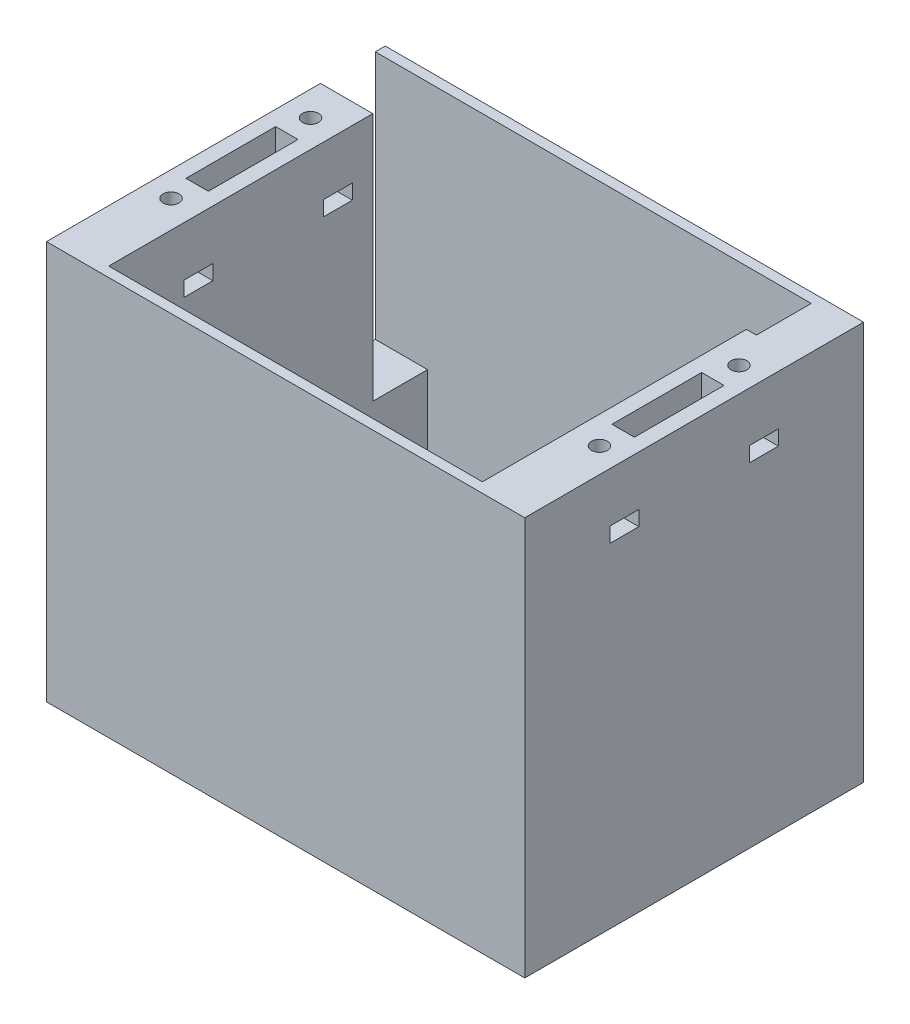
from build123d import *

# Parameters (mm, degrees)
SKETCH1_W                       = 96
SKETCH1_H                       = 68
BOSS_EXTRUDE1_DEPTH             = 80
SKETCH2_W                       = 75
SKETCH2_H                       = 64
CUT_EXTRUDE1_DEPTH              = 45
SKETCH3_W                       = 30
SKETCH3_H                       = 32
CUT_EXTRUDE2_DEPTH              = 8
SKETCH9_R                       = 1.8
CUT_EXTRUDE5_DEPTH              = 80.177016867
CHAMFER1_SIZE                   = 10
SKETCH10_R                      = 10
SKETCH10_R_2                    = 3.8
CUT_EXTRUDE7_DEPTH              = 13
CHAMFER2_SIZE                   = 3
CUT_EXTRUDE8_DEPTH              = 25
SKETCH12_R                      = 1.6
SKETCH12_W                      = 4.5
SKETCH12_H                      = 18
CUT_EXTRUDE9_DEPTH              = 70
SKETCH13_W                      = 5.8
SKETCH13_H                      = 3
CUT_EXTRUDE10_DEPTH             = 130.50675658
CUT_EXTRUDE11_DEPTH             = 5
CUT_EXTRUDE11_DIRECTION_2_REACH = 76.061


with BuildPart() as part:
    # Sketch1 → Boss-Extrude1 (new body)
    with BuildSketch(Plane(origin=(0, 0, 0), x_dir=(1, 0, 0), z_dir=(0, 1, 0))):
        Rectangle(SKETCH1_W, SKETCH1_H)
    extrude(amount=BOSS_EXTRUDE1_DEPTH)

    # Sketch2 → Cut-Extrude1 (cut)
    with BuildSketch(Plane(origin=(0, 80, 0), x_dir=(1, 0, 0), z_dir=(0, 1, 0))):
        Rectangle(SKETCH2_W, SKETCH2_H)
    extrude(amount=-CUT_EXTRUDE1_DEPTH, mode=Mode.SUBTRACT)

    # Sketch3 → Cut-Extrude2 (cut)
    with BuildSketch(Plane(origin=(0, 35, 0), x_dir=(1, 0, 0), z_dir=(0, 1, 0))):
        with Locations((11.5, -4)):
            Rectangle(SKETCH3_W, SKETCH3_H)
    extrude(amount=-CUT_EXTRUDE2_DEPTH, mode=Mode.SUBTRACT)

    # Sketch9 → Cut-Extrude5 (cut, through all)
    with BuildSketch(Plane(origin=(0, 27, 0), x_dir=(1, 0, 0), z_dir=(0, 1, 0))):
        with Locations(Location((11.5, -4, 0), (0, 0, 270))):
            Circle(SKETCH9_R)
    extrude(amount=-CUT_EXTRUDE5_DEPTH, mode=Mode.SUBTRACT)

    # Chamfer1
    chamfer1_edges = [part.edges().sort_by_distance(p)[0] for p in [
        (11.5, 27, 2.2),
    ]]
    chamfer(chamfer1_edges, length=CHAMFER1_SIZE)

    # Sketch10 → Cut-Extrude7 (cut)
    with BuildSketch(Plane.XZ):
        with Locations(Location((11.5, 4, 0), (0, 0, 270))):
            Circle(SKETCH10_R)
        with Locations(Location((11.5, 4, 0), (0, 0, 270))):
            Circle(SKETCH10_R_2, mode=Mode.SUBTRACT)
    extrude(amount=-CUT_EXTRUDE7_DEPTH, mode=Mode.SUBTRACT)

    # Chamfer2
    chamfer2_edges = [part.edges().sort_by_distance(p)[0] for p in [
        (11.5, 13, 14),
        (11.5, 13, 7.8),
    ]]
    chamfer(chamfer2_edges, length=CHAMFER2_SIZE)

    # Sketch11 → Cut-Extrude8 (cut)
    with BuildSketch(Plane(origin=(0, 35, 0), x_dir=(1, 0, 0), z_dir=(0, 1, 0))):
        Polygon((9.5, 32), (-37.5, 32), (-37.5, 2), (-7.5, 2), (-7.5, 16), (9.5, 16), align=None)
        Polygon((-7.5, -2), (-37.5, -2), (-37.5, -32), (9.5, -32), (9.5, -24), (-7.5, -24), align=None)
        Polygon((37.5, -32), (37.5, -2), (30.5, -2), (30.5, -24), (13.5, -24), (13.5, -32), align=None)
        Polygon((37.5, 32), (13.5, 32), (13.5, 16), (30.5, 16), (30.5, 2), (37.5, 2), align=None)
    extrude(amount=-CUT_EXTRUDE8_DEPTH, mode=Mode.SUBTRACT)

    # Sketch12 → Cut-Extrude9 (cut)
    with BuildSketch(Plane(origin=(0, 80, 0), x_dir=(1, 0, 0), z_dir=(0, 1, 0))):
        with Locations(Location((-43, 14, 0), (0, 0, 270))):
            Circle(SKETCH12_R)
        with Locations(Location((-43, -14, 0), (0, 0, 90))):
            Circle(SKETCH12_R)
        with Locations(Location((43, -14, 0), (0, 0, 270))):
            Circle(SKETCH12_R)
        with Locations(Location((43, 14, 0), (0, 0, 90))):
            Circle(SKETCH12_R)
        with Locations((-42.75, 0)):
            Rectangle(SKETCH12_W, SKETCH12_H)
        with Locations((42.75, 0)):
            Rectangle(SKETCH12_W, SKETCH12_H)
    extrude(amount=-CUT_EXTRUDE9_DEPTH, mode=Mode.SUBTRACT)

    # Sketch13 → Cut-Extrude10 (cut, through all)
    with BuildSketch(Plane.ZY.offset(48)):
        with Locations((-14, 68.5)):
            Rectangle(SKETCH13_W, SKETCH13_H)
        with Locations((14, 68.5)):
            Rectangle(SKETCH13_W, SKETCH13_H)
    extrude(amount=-CUT_EXTRUDE10_DEPTH, mode=Mode.SUBTRACT)

    # Sketch15 → Cut-Extrude11 (cut)
    with BuildSketch(Plane(origin=(0, 35, 0), x_dir=(1, 0, 0), z_dir=(0, 1, 0))):
        Polygon((-57.5, 28), (-57.5, 21), (39.5, 21), (39.5, 28), (39.5, 32), (-57.5, 32), align=None)
    extrude(amount=-CUT_EXTRUDE11_DEPTH, mode=Mode.SUBTRACT)

    # Cut-Extrude11 direction 2: up to this face of the body (flat: up to its plane)
    cut_extrude11_direction_2_end = Plane(part.part.faces().sort_by_distance((0, 80, -32.823564706))[0])
    # Sketch15 → Cut-Extrude11 direction 2 (cut, up to the picked face)
    with BuildSketch(Plane(origin=(0, 35, 0), x_dir=(1, 0, 0), z_dir=(0, 1, 0)), mode=Mode.PRIVATE) as cut_extrude11_direction_2_sk1:
        Polygon((-57.5, 28), (-57.5, 21), (39.5, 21), (39.5, 28), (39.5, 32), (-57.5, 32), align=None)
    cut_extrude11_direction_2_tool1 = split(extrude(cut_extrude11_direction_2_sk1.sketch, amount=CUT_EXTRUDE11_DIRECTION_2_REACH, mode=Mode.PRIVATE), bisect_by=cut_extrude11_direction_2_end, keep=Keep.BOTH, mode=Mode.PRIVATE)
    add(cut_extrude11_direction_2_tool1.solids().sort_by(Axis((-9, 35, -26.5), (0, 1, 0)))[0], mode=Mode.SUBTRACT)


solid = part.part
